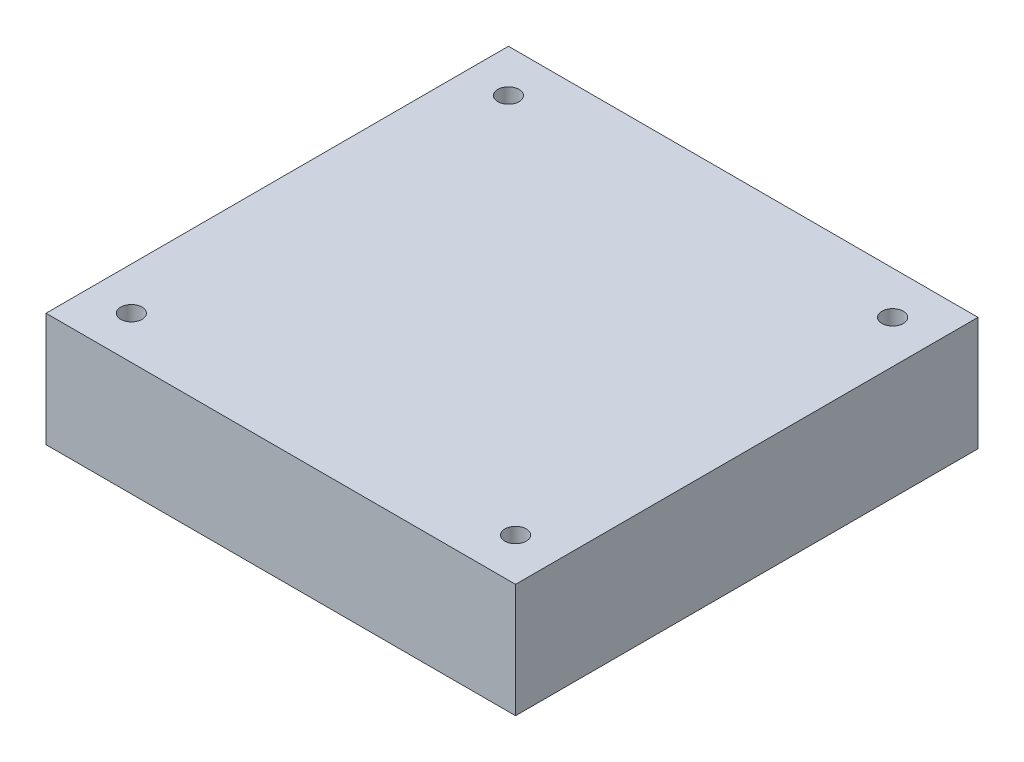
from build123d import *

# Parameters (mm, degrees)
SKETCH1_W           = 66
SKETCH1_H           = 65
BOSS_EXTRUDE1_DEPTH = 16
SKETCH2_R           = 1.5
CUT_EXTRUDE1_DEPTH  = 16


with BuildPart() as part:
    # Sketch1 → Boss-Extrude1 (new body)
    with BuildSketch(Plane(origin=(0, 0, 0), x_dir=(1, 0, 0), z_dir=(0, 1, 0))):
        Rectangle(SKETCH1_W, SKETCH1_H)
    extrude(amount=BOSS_EXTRUDE1_DEPTH)

    # Sketch2 → Cut-Extrude1 (cut)
    with BuildSketch(Plane(origin=(0, 16, 0), x_dir=(1, 0, 0), z_dir=(0, 1, 0))):
        with Locations(Location((-27, 26.5, 0), (0, 0, 270))):
            Circle(SKETCH2_R)
        with Locations(Location((27, 26.5, 0), (0, 0, 270))):
            Circle(SKETCH2_R)
        with Locations(Location((27, -26.5, 0), (0, 0, 270))):
            Circle(SKETCH2_R)
        with Locations(Location((-27, -26.5, 0), (0, 0, 270))):
            Circle(SKETCH2_R)
    extrude(amount=-CUT_EXTRUDE1_DEPTH, mode=Mode.SUBTRACT)


solid = part.part
